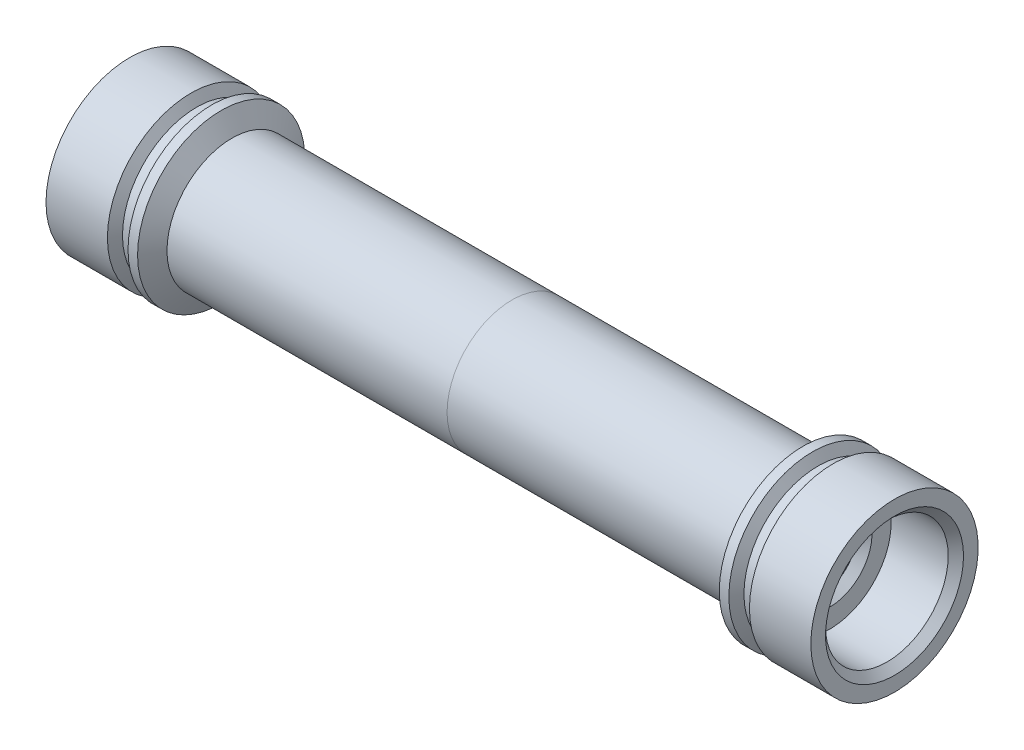
from build123d import *

# Parameters (mm, degrees)
CHAMFER1_SIZE = 0.508


with BuildPart() as part:
    # Sketch2 → Revolve1 (revolve)
    with BuildSketch(Plane.XY, mode=Mode.PRIVATE) as revolve1_sk:
        Polygon((-21.321617421, 5.55625), (-25.4, 5.55625), (-25.4, 4.075), (-21.099999964, 4.075), (-21.099999964, 2.805), (-20.591999964, 2.297), (-20.591999964, 1.905), (-15.448, 1.905), (-15.448, 0), (-14.125000052, 0), (-12.5, 1.625000052), (0, 1.625000052), (0, 4.318), (-18.603478608, 4.318), (-19.318382579, 5.55625), (-19.953382579, 5.55625), (-20.32, 4.92125), (-20.955, 4.92125), align=None)
    revolve(revolve1_sk.sketch.rotate(Axis((-25.4, 0, 0), (1, 0, 0)), 90), axis=Axis((-25.4, 0, 0), (1, 0, 0)))

    # Chamfer1
    chamfer1_edges = [part.edges().sort_by_distance(p)[0] for p in [
        (-25.4, 0, -4.075),
    ]]
    chamfer(chamfer1_edges, length=CHAMFER1_SIZE)


with BuildPart() as body_2:
    # Mirror1: mirrored copy
    add(part.part.mirror(Plane(origin=(0, 0, 0), x_dir=(0, 0, 1), z_dir=(1, 0, 0))))


solid = Compound([part.part, body_2.part])
